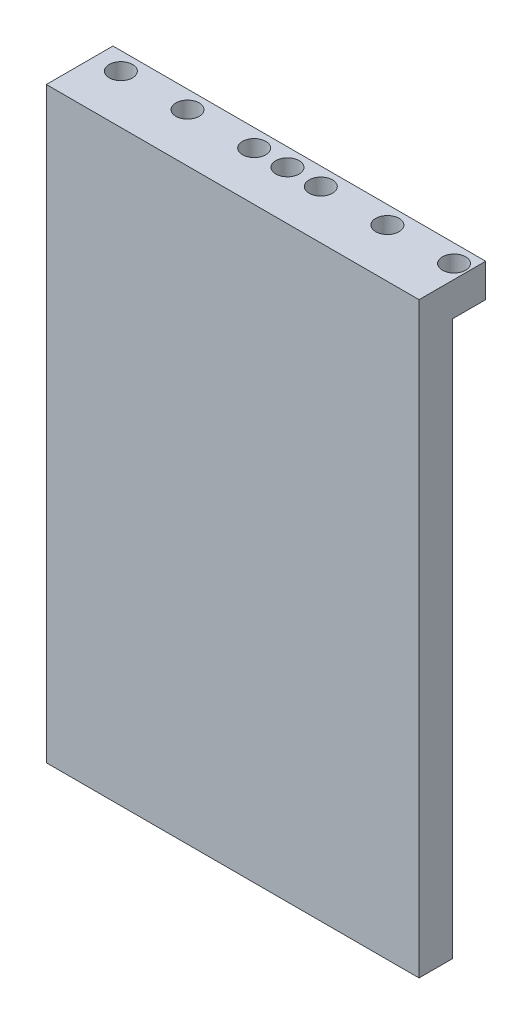
from build123d import *

# Parameters (mm, degrees)
ESQUISSE1_W             = 176.318824712
ESQUISSE1_H             = 111.873178338
BOSS_EXTRU_1_DEPTH      = 10
ESQUISSE2_W             = 111.873178338
ESQUISSE2_H             = 10
BOSS_EXTRU_3_DEPTH      = 10
ESQUISSE3_R             = 3.5
ENL_V_MAT_EXTRU_1_DEPTH = 10
ESQUISSE4_R             = 3.5
ENL_V_MAT_EXTRU_2_DEPTH = 10
ESQUISSE5_R             = 3.5
ENL_V_MAT_EXTRU_4_DEPTH = 10


with BuildPart() as part:
    # Esquisse1 → Boss.-Extru.1 (new body)
    with BuildSketch(Plane(origin=(0, 0, 0), x_dir=(0, 1, 0), z_dir=(0, 0, 1))):
        Rectangle(ESQUISSE1_W, ESQUISSE1_H)
    extrude(amount=BOSS_EXTRU_1_DEPTH)

    # Esquisse2 → Boss.-Extru.3 (add)
    with BuildSketch(Plane(origin=(0, 88.159412356, 0), x_dir=(-1, 0, 0), z_dir=(0, 1, 0))):
        with Locations((0, -5)):
            Rectangle(ESQUISSE2_W, ESQUISSE2_H)
    extrude(amount=-BOSS_EXTRU_3_DEPTH)

    # Esquisse3 → Enlèv. mat.-Extru.1 (cut)
    with BuildSketch(Plane.XZ.offset(-78.159412356)):
        with Locations(Location((11.791315902, -4.654466803, 0), (0, 0, 270))):
            Circle(ESQUISSE3_R)
        with Locations(Location((1.791315902, -4.654466803, 0), (0, 0, 270))):
            Circle(ESQUISSE3_R)
        with Locations(Location((-8.208684098, -4.654466803, 0), (0, 0, 270))):
            Circle(ESQUISSE3_R)
    extrude(amount=-ENL_V_MAT_EXTRU_1_DEPTH, mode=Mode.SUBTRACT)

    # Esquisse4 → Enlèv. mat.-Extru.2 (cut)
    with BuildSketch(Plane(origin=(0, 88.159412356, 0), x_dir=(-1, 0, 0), z_dir=(0, 1, 0))):
        with Locations(Location((-31.791315902, -4.654466803, 0), (0, 0, 90))):
            Circle(ESQUISSE4_R)
        with Locations(Location((28.208684098, -4.654466803, 0), (0, 0, 90))):
            Circle(ESQUISSE4_R)
    extrude(amount=-ENL_V_MAT_EXTRU_2_DEPTH, mode=Mode.SUBTRACT)

    # Esquisse5 → Enlèv. mat.-Extru.4 (cut)
    with BuildSketch(Plane(origin=(0, 88.159412356, 0), x_dir=(1, 0, 0), z_dir=(0, 1, 0))):
        with Locations(Location((-48.208684098, 4.654466803, 0), (0, 0, 270))):
            Circle(ESQUISSE5_R)
        with Locations(Location((51.791315902, 4.654466803, 0), (0, 0, 270))):
            Circle(ESQUISSE5_R)
    extrude(amount=-ENL_V_MAT_EXTRU_4_DEPTH, mode=Mode.SUBTRACT)


solid = part.part
